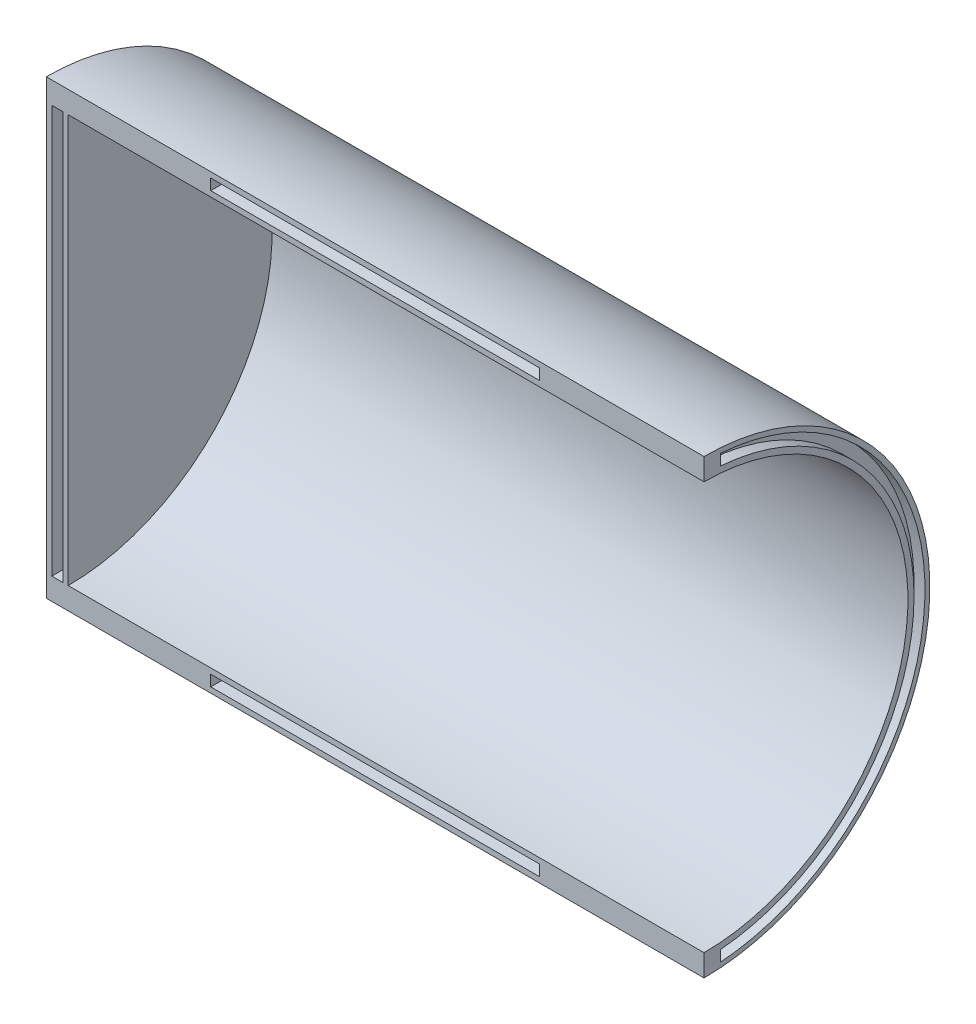
from build123d import *

# Parameters (mm, degrees)
REVOLVE1_ANGLE     = 180
SKETCH4_W          = 2.54
SKETCH4_H          = 94.488
SKETCH4_W_2        = 76.2
SKETCH4_H_2        = 2.54
CUT_EXTRUDE1_DEPTH = 2.54
CUT_EXTRUDE2_DEPTH = 2.54


with BuildPart() as part:
    # Sketch1 → Revolve1 (revolve)
    with BuildSketch(Plane.XY):
        Polygon((0, 0), (0, 52.324), (152.4, 52.324), (152.4, 47.244), (5.08, 47.244), (5.08, 0), align=None)
    revolve(axis=Axis((5.08, 0, 0), (-1, 0, 0)), revolution_arc=REVOLVE1_ANGLE)

    # Sketch4 → Cut-Extrude1 (cut)
    with BuildSketch(Plane.XY):
        with Locations((2.54, 0)):
            Rectangle(SKETCH4_W, SKETCH4_H)
        with Locations((76.2, 49.784)):
            Rectangle(SKETCH4_W_2, SKETCH4_H_2)
        with Locations((76.2, -49.784)):
            Rectangle(SKETCH4_W_2, SKETCH4_H_2)
    extrude(amount=-CUT_EXTRUDE1_DEPTH, mode=Mode.SUBTRACT)

    # Sketch5 → Cut-Extrude2 (cut)
    with BuildSketch(Plane(origin=(152.4, 0, 0), x_dir=(0, 0, -1), z_dir=(1, 0, 0))):
        with BuildLine():
            Line((3.81, 51.054), (3.81, 48.514))
            ThreePointArc((3.81, 48.514), (48.663377359, 0), (3.81, -48.514))
            Line((3.81, -48.514), (3.81, -51.054))
            ThreePointArc((3.81, -51.054), (51.195966794, 0), (3.81, 51.054))
        make_face()
    extrude(amount=-CUT_EXTRUDE2_DEPTH, mode=Mode.SUBTRACT)


solid = part.part
